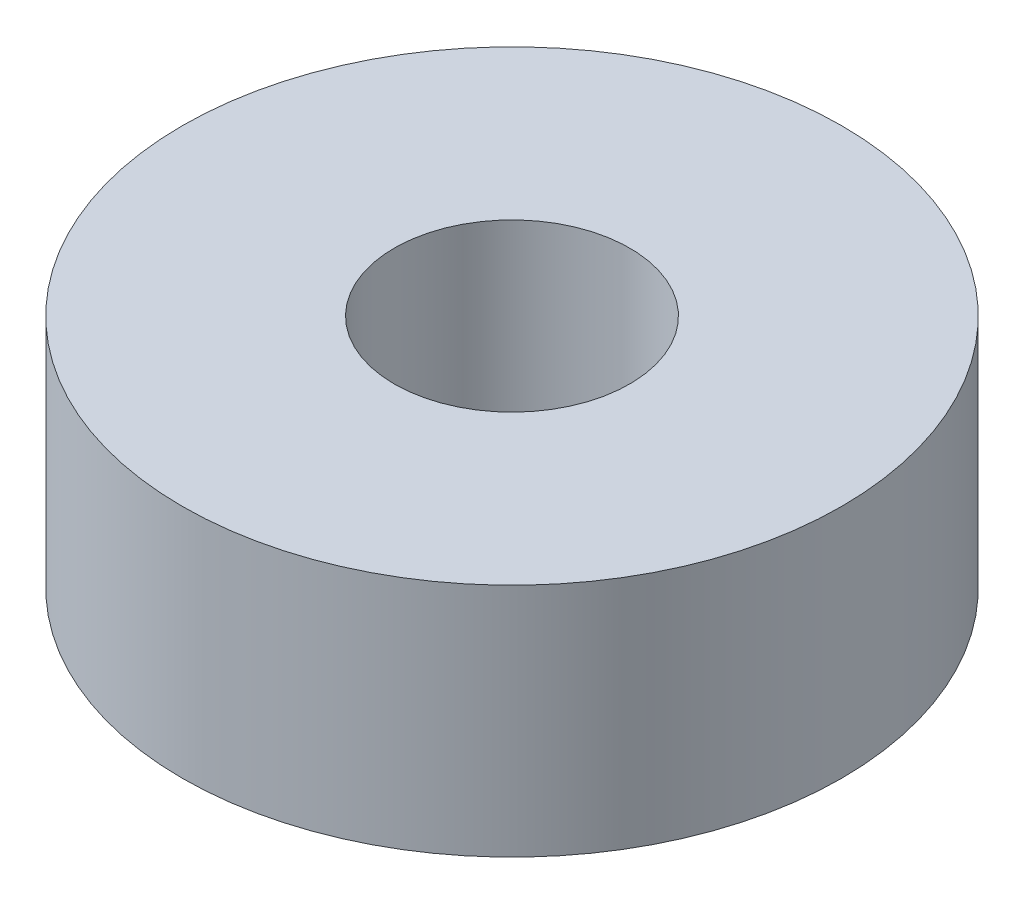
from build123d import *

# Parameters (mm, degrees)
SKETCH1_R           = 7
SKETCH1_R_2         = 2.5
BOSS_EXTRUDE1_DEPTH = 5


with BuildPart() as part:
    # Sketch1 → Boss-Extrude1 (new body)
    with BuildSketch(Plane(origin=(0, 0, 0), x_dir=(1, 0, 0), z_dir=(0, 1, 0))):
        with Locations(Location((0, 0, 0), (0, 0, 270))):
            Circle(SKETCH1_R)
        with Locations(Location((0, 0, 0), (0, 0, 270))):
            Circle(SKETCH1_R_2, mode=Mode.SUBTRACT)
    extrude(amount=BOSS_EXTRUDE1_DEPTH)


solid = part.part
